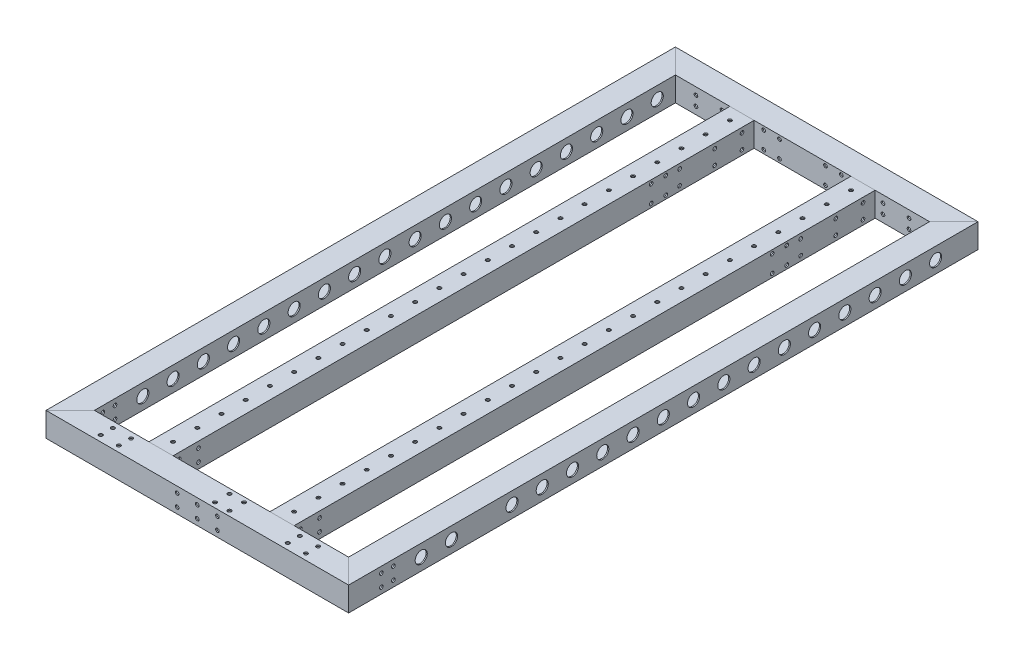
from build123d import *

# Parameters (mm, degrees)
WL_20X20X1_1_DEPTH         = 245.142135624
WL_20X20X1_1_DEPTH_BACK    = 15.142135624
SKETCH_11_W                = 20
SKETCH_11_H                = 20
SKETCH_11_W_2              = 18
SKETCH_11_H_2              = 18
SKETCH_11_ON_SEGMENT_2_W   = 20
SKETCH_11_ON_SEGMENT_2_H   = 20
SKETCH_11_ON_SEGMENT_2_W_2 = 18
SKETCH_11_ON_SEGMENT_2_H_2 = 18
WL_20X20X1_1_2_DEPTH       = 530.284271247
SKETCH_11_ON_SEGMENT_3_W   = 20
SKETCH_11_ON_SEGMENT_3_H   = 20
SKETCH_11_ON_SEGMENT_3_W_2 = 18
SKETCH_11_ON_SEGMENT_3_H_2 = 18
WL_20X20X1_1_3_DEPTH       = 260.284271247
SKETCH_11_ON_SEGMENT_4_W   = 20
SKETCH_11_ON_SEGMENT_4_H   = 20
SKETCH_11_ON_SEGMENT_4_W_2 = 18
SKETCH_11_ON_SEGMENT_4_H_2 = 18
WL_20X20X1_1_4_DEPTH       = 530.284271247
SKETCH_11_ON_SEGMENT_5_W   = 20
SKETCH_11_ON_SEGMENT_5_H   = 20
SKETCH_11_ON_SEGMENT_5_W_2 = 18
SKETCH_11_ON_SEGMENT_5_H_2 = 18
WL_20X20X1_1_5_DEPTH       = 502
SKETCH_11_ON_SEGMENT_6_W   = 20
SKETCH_11_ON_SEGMENT_6_H   = 20
SKETCH_11_ON_SEGMENT_6_W_2 = 18
SKETCH_11_ON_SEGMENT_6_H_2 = 18
WL_20X20X1_1_6_DEPTH       = 502
SKETCH_14_R                = 1.5
CUT_EXTRUDE_2_DEPTH        = 20
SKETCH_15_R                = 1.5
CUT_EXTRUDE_3_DEPTH        = 20
SKETCH_19_R                = 1.5
CUT_EXTRUDE_7_DEPTH        = 20
SKETCH_20_R                = 1.5
CUT_EXTRUDE_8_DEPTH        = 20
CUT_EXTRUDE_START          = -120
SKETCH_22_R                = 1.5
CUT_EXTRUDE_9_DEPTH        = 120
SKETCH_23_R                = 1.5
CUT_EXTRUDE_10_DEPTH       = 20
SKETCH_24_R                = 1.5
CUT_EXTRUDE_11_DEPTH       = 130
CUT_EXTRUDE_12_DEPTH       = 100
CUT_EXTRUDE_12_DEPTH_BACK  = 20
SKETCH_25_R                = 1.5
SKETCH_26_R                = 1.5
CUT_EXTRUDE_13_DEPTH       = 290.179874818
SKETCH_28_R                = 5
CUT_EXTRUDE_15_DEPTH       = 20
SKETCH_29_R                = 5
CUT_EXTRUDE_16_DEPTH       = 20
SKETCH_30_R                = 1.5
CUT_EXTRUDE_17_DEPTH       = 290.179874818


with BuildPart() as part:
    # 草图11 → Wl 20X20X1(1) (new, two sides: drawn at the far end of the back side and taken through both)
    with BuildSketch(Plane(origin=(-115, 0, -250), x_dir=(0, 0, -1), z_dir=(1, 0, 0)).offset(-WL_20X20X1_1_DEPTH_BACK)):
        Rectangle(SKETCH_11_W, SKETCH_11_H)
        Rectangle(SKETCH_11_W_2, SKETCH_11_H_2, mode=Mode.SUBTRACT)
    extrude(amount=WL_20X20X1_1_DEPTH + WL_20X20X1_1_DEPTH_BACK)

    # Wl 20X20X1(1) mitre 1
    split(bisect_by=Plane(origin=(-115, 0, -250), x_dir=(0, 1, 0), z_dir=(0.707106781, 0, -0.707106781)), keep=Keep.TOP)

    # Wl 20X20X1(1) mitre 2
    split(bisect_by=Plane(origin=(115, 0, -250), x_dir=(0, -1, 0), z_dir=(-0.707106781, 0, -0.707106781)), keep=Keep.TOP)

    # 草图15 → 切除-拉伸3 (cut)
    with BuildSketch(Plane(origin=(51.249198072, -42.818573255, -240), x_dir=(1, 0, 0), z_dir=(0, 0, 1))):
        with Locations((15.250801928, 38.818573255)):
            Circle(SKETCH_15_R)
        with Locations((15.250801928, 46.818573255)):
            Circle(SKETCH_15_R)
        with Locations((36.750801928, 46.818573255)):
            Circle(SKETCH_15_R)
        with Locations((36.750801928, 38.818573255)):
            Circle(SKETCH_15_R)
        with Locations((-139.249198072, 38.818573255)):
            Circle(SKETCH_15_R)
        with Locations((-139.249198072, 46.818573255)):
            Circle(SKETCH_15_R)
        with Locations((-117.749198072, 38.818573255)):
            Circle(SKETCH_15_R)
        with Locations((-117.749198072, 46.818573255)):
            Circle(SKETCH_15_R)
        with Locations((-70.249198072, 35.818573255)):
            Circle(SKETCH_15_R)
        with Locations((-70.249198072, 49.818573255)):
            Circle(SKETCH_15_R)
        with Locations((-83.249198072, 35.818573255)):
            Circle(SKETCH_15_R)
        with Locations((-83.249198072, 49.818573255)):
            Circle(SKETCH_15_R)
        with Locations((-32.249198072, 49.818573255)):
            Circle(SKETCH_15_R)
        with Locations((-32.249198072, 35.818573255)):
            Circle(SKETCH_15_R)
        with Locations((-19.249198072, 35.818573255)):
            Circle(SKETCH_15_R)
        with Locations((-19.249198072, 49.818573255)):
            Circle(SKETCH_15_R)
    extrude(amount=-CUT_EXTRUDE_3_DEPTH, mode=Mode.SUBTRACT)


with BuildPart() as body_2:
    # 草图11 on segment 2 (carried to segment 2) → Wl 20X20X1_1 2 (new body)
    with BuildSketch(Plane(origin=(115, 0, -265.142135624), x_dir=(1, 0, 0), z_dir=(0, 0, 1))):
        Rectangle(SKETCH_11_ON_SEGMENT_2_W, SKETCH_11_ON_SEGMENT_2_H)
        Rectangle(SKETCH_11_ON_SEGMENT_2_W_2, SKETCH_11_ON_SEGMENT_2_H_2, mode=Mode.SUBTRACT)
    extrude(amount=WL_20X20X1_1_2_DEPTH)

    # Wl 20X20X1_1 2 mitre 1
    split(bisect_by=Plane(origin=(115, 0, 250), x_dir=(0, 1, 0), z_dir=(0.707106781, 0, -0.707106781)), keep=Keep.TOP)

    # Wl 20X20X1_1 2 mitre 2
    split(bisect_by=Plane(origin=(115, 0, -250), x_dir=(0, 1, 0), z_dir=(0.707106781, 0, 0.707106781)), keep=Keep.TOP)

    # 草图20 → 切除-拉伸8 (cut)
    with BuildSketch(Plane(origin=(125, 0, 0), x_dir=(0, 0, -1), z_dir=(1, 0, 0))):
        with Locations(Location((-233, 5, 0), (0, 0, 180))):
            Circle(SKETCH_20_R)
        with Locations(Location((-223, 5, 0), (0, 0, 180))):
            Circle(SKETCH_20_R)
        with Locations(Location((-223, -5, 0), (0, 0, 180))):
            Circle(SKETCH_20_R)
        with Locations(Location((-233, -5, 0), (0, 0, 180))):
            Circle(SKETCH_20_R)
    extrude(amount=-CUT_EXTRUDE_8_DEPTH, mode=Mode.SUBTRACT)

    # 草图28 → 切除-拉伸15 (cut)
    with BuildSketch(Plane(origin=(125, 0, 0), x_dir=(0, 0, -1), z_dir=(1, 0, 0))):
        Circle(SKETCH_28_R)
        with Locations((25, 0)):
            Circle(SKETCH_28_R)
        with Locations((50, 0)):
            Circle(SKETCH_28_R)
        with Locations((75, 0)):
            Circle(SKETCH_28_R)
        with Locations((100, 0)):
            Circle(SKETCH_28_R)
        with Locations((125, 0)):
            Circle(SKETCH_28_R)
        with Locations((150, 0)):
            Circle(SKETCH_28_R)
        with Locations((175, 0)):
            Circle(SKETCH_28_R)
        with Locations((200, 0)):
            Circle(SKETCH_28_R)
        with Locations((225, 0)):
            Circle(SKETCH_28_R)
        with Locations(Location((-200, 0, 0), (0, 0, 180))):
            Circle(SKETCH_28_R)
        with Locations(Location((-175, 0, 0), (0, 0, 180))):
            Circle(SKETCH_28_R)
        with Locations(Location((-125, 0, 0), (0, 0, 180))):
            Circle(SKETCH_28_R)
        with Locations(Location((-100, 0, 0), (0, 0, 180))):
            Circle(SKETCH_28_R)
        with Locations(Location((-75, 0, 0), (0, 0, 180))):
            Circle(SKETCH_28_R)
        with Locations(Location((-50, 0, 0), (0, 0, 180))):
            Circle(SKETCH_28_R)
        with Locations(Location((-25, 0, 0), (0, 0, 180))):
            Circle(SKETCH_28_R)
    extrude(amount=-CUT_EXTRUDE_15_DEPTH, mode=Mode.SUBTRACT)


with BuildPart() as body_3:
    # 草图11 on segment 3 (carried to segment 3) → Wl 20X20X1_1 3 (new body)
    with BuildSketch(Plane(origin=(130.142135624, 0, 250), x_dir=(0, 0, 1), z_dir=(-1, 0, 0))):
        Rectangle(SKETCH_11_ON_SEGMENT_3_W, SKETCH_11_ON_SEGMENT_3_H)
        Rectangle(SKETCH_11_ON_SEGMENT_3_W_2, SKETCH_11_ON_SEGMENT_3_H_2, mode=Mode.SUBTRACT)
    extrude(amount=WL_20X20X1_1_3_DEPTH)

    # Wl 20X20X1_1 3 mitre 1
    split(bisect_by=Plane(origin=(-115, 0, 250), x_dir=(0, 1, 0), z_dir=(0.707106781, 0, 0.707106781)), keep=Keep.TOP)

    # Wl 20X20X1_1 3 mitre 2
    split(bisect_by=Plane(origin=(115, 0, 250), x_dir=(0, -1, 0), z_dir=(-0.707106781, 0, 0.707106781)), keep=Keep.TOP)

    # 草图23 → 切除-拉伸10 (cut)
    with BuildSketch(Plane.XY.offset(260)):
        with Locations((-16.6, 5)):
            Circle(SKETCH_23_R)
        with Locations(Location((16.6, 5, 0), (0, 0, 180))):
            Circle(SKETCH_23_R)
        with Locations(Location((-16.6, -5, 0), (0, 0, 180))):
            Circle(SKETCH_23_R)
        with Locations((16.6, -5)):
            Circle(SKETCH_23_R)
        with Locations((0, 5)):
            Circle(SKETCH_23_R)
        with Locations((0, -5)):
            Circle(SKETCH_23_R)
    extrude(amount=-CUT_EXTRUDE_10_DEPTH, mode=Mode.SUBTRACT)

    # 草图26 → 切除-拉伸13 (cut, through all)
    with BuildSketch(Plane(origin=(0, 10, 0), x_dir=(1, 0, 0), z_dir=(0, 1, 0))):
        with Locations(Location((10.6, -244, 0), (0, 0, 270))):
            Circle(SKETCH_26_R)
        with Locations(Location((22.6, -244, 0), (0, 0, 270))):
            Circle(SKETCH_26_R)
        with Locations(Location((10.6, -256, 0), (0, 0, 270))):
            Circle(SKETCH_26_R)
        with Locations(Location((22.6, -256, 0), (0, 0, 270))):
            Circle(SKETCH_26_R)
    extrude(amount=-CUT_EXTRUDE_13_DEPTH, mode=Mode.SUBTRACT)

    # 草图30 → 切除-拉伸17 (cut, through all)
    with BuildSketch(Plane(origin=(0, 10, 0), x_dir=(1, 0, 0), z_dir=(0, 1, 0))):
        with Locations(Location((69.75, -245, 0), (0, 0, 270))):
            Circle(SKETCH_30_R)
        with Locations(Location((84.75, -245, 0), (0, 0, 270))):
            Circle(SKETCH_30_R)
        with Locations(Location((84.75, -255, 0), (0, 0, 270))):
            Circle(SKETCH_30_R)
        with Locations(Location((69.75, -255, 0), (0, 0, 270))):
            Circle(SKETCH_30_R)
        with Locations(Location((-69.75, -255, 0), (0, 0, 270))):
            Circle(SKETCH_30_R)
        with Locations(Location((-84.75, -255, 0), (0, 0, 270))):
            Circle(SKETCH_30_R)
        with Locations(Location((-84.75, -245, 0), (0, 0, 270))):
            Circle(SKETCH_30_R)
        with Locations(Location((-69.75, -245, 0), (0, 0, 270))):
            Circle(SKETCH_30_R)
    extrude(amount=-CUT_EXTRUDE_17_DEPTH, mode=Mode.SUBTRACT)


with BuildPart() as body_4:
    # 草图11 on segment 4 (carried to segment 4) → Wl 20X20X1_1 4 (new body)
    with BuildSketch(Plane(origin=(-115, 0, 265.142135624), x_dir=(-1, 0, 0), z_dir=(0, 0, -1))):
        Rectangle(SKETCH_11_ON_SEGMENT_4_W, SKETCH_11_ON_SEGMENT_4_H)
        Rectangle(SKETCH_11_ON_SEGMENT_4_W_2, SKETCH_11_ON_SEGMENT_4_H_2, mode=Mode.SUBTRACT)
    extrude(amount=WL_20X20X1_1_4_DEPTH)

    # Wl 20X20X1_1 4 mitre 1
    split(bisect_by=Plane(origin=(-115, 0, 250), x_dir=(0, -1, 0), z_dir=(-0.707106781, 0, -0.707106781)), keep=Keep.TOP)

    # Wl 20X20X1_1 4 mitre 2
    split(bisect_by=Plane(origin=(-115, 0, -250), x_dir=(0, -1, 0), z_dir=(-0.707106781, 0, 0.707106781)), keep=Keep.TOP)

    # 草图19 → 切除-拉伸7 (cut)
    with BuildSketch(Plane.ZY.offset(125)):
        with Locations((223, 5)):
            Circle(SKETCH_19_R)
        with Locations((223, -5)):
            Circle(SKETCH_19_R)
        with Locations((233, -5)):
            Circle(SKETCH_19_R)
        with Locations((233, 5)):
            Circle(SKETCH_19_R)
    extrude(amount=-CUT_EXTRUDE_7_DEPTH, mode=Mode.SUBTRACT)

    # 草图29 → 切除-拉伸16 (cut)
    with BuildSketch(Plane.ZY.offset(125)):
        Circle(SKETCH_29_R)
        with Locations((25, 0)):
            Circle(SKETCH_29_R)
        with Locations((50, 0)):
            Circle(SKETCH_29_R)
        with Locations((75, 0)):
            Circle(SKETCH_29_R)
        with Locations((100, 0)):
            Circle(SKETCH_29_R)
        with Locations((125, 0)):
            Circle(SKETCH_29_R)
        with Locations((150, 0)):
            Circle(SKETCH_29_R)
        with Locations((175, 0)):
            Circle(SKETCH_29_R)
        with Locations((200, 0)):
            Circle(SKETCH_29_R)
        with Locations(Location((-225, 0, 0), (0, 0, 180))):
            Circle(SKETCH_29_R)
        with Locations(Location((-200, 0, 0), (0, 0, 180))):
            Circle(SKETCH_29_R)
        with Locations(Location((-175, 0, 0), (0, 0, 180))):
            Circle(SKETCH_29_R)
        with Locations(Location((-150, 0, 0), (0, 0, 180))):
            Circle(SKETCH_29_R)
        with Locations(Location((-125, 0, 0), (0, 0, 180))):
            Circle(SKETCH_29_R)
        with Locations(Location((-100, 0, 0), (0, 0, 180))):
            Circle(SKETCH_29_R)
        with Locations(Location((-75, 0, 0), (0, 0, 180))):
            Circle(SKETCH_29_R)
        with Locations(Location((-50, 0, 0), (0, 0, 180))):
            Circle(SKETCH_29_R)
        with Locations(Location((-25, 0, 0), (0, 0, 180))):
            Circle(SKETCH_29_R)
    extrude(amount=-CUT_EXTRUDE_16_DEPTH, mode=Mode.SUBTRACT)


with BuildPart() as body_5:
    # 草图11 on segment 5 (carried to segment 5) → Wl 20X20X1_1 5 (new body)
    with BuildSketch(Plane(origin=(-50, 0, -251), x_dir=(1, 0, 0), z_dir=(0, 0, 1))):
        Rectangle(SKETCH_11_ON_SEGMENT_5_W, SKETCH_11_ON_SEGMENT_5_H)
        Rectangle(SKETCH_11_ON_SEGMENT_5_W_2, SKETCH_11_ON_SEGMENT_5_H_2, mode=Mode.SUBTRACT)
    extrude(amount=WL_20X20X1_1_5_DEPTH)

    # Wl 20X20X1_1 5 mitre 1
    split(bisect_by=Plane(origin=(-50, 0, -240), x_dir=(0, -1, 0), z_dir=(0, 0, 1)), keep=Keep.TOP)

    # Wl 20X20X1_1 5 mitre 2
    split(bisect_by=Plane(origin=(-50, 0, 240), x_dir=(0, 1, 0), z_dir=(0, 0, -1)), keep=Keep.TOP)


with BuildPart() as body_6:
    # 草图11 on segment 6 (carried to segment 6) → Wl 20X20X1_1 6 (new body)
    with BuildSketch(Plane(origin=(50, 0, -251), x_dir=(1, 0, 0), z_dir=(0, 0, 1))):
        Rectangle(SKETCH_11_ON_SEGMENT_6_W, SKETCH_11_ON_SEGMENT_6_H)
        Rectangle(SKETCH_11_ON_SEGMENT_6_W_2, SKETCH_11_ON_SEGMENT_6_H_2, mode=Mode.SUBTRACT)
    extrude(amount=WL_20X20X1_1_6_DEPTH)

    # Wl 20X20X1_1 6 mitre 1
    split(bisect_by=Plane(origin=(50, 0, -240), x_dir=(0, -1, 0), z_dir=(0, 0, 1)), keep=Keep.TOP)

    # Wl 20X20X1_1 6 mitre 2
    split(bisect_by=Plane(origin=(50, 0, 240), x_dir=(0, 1, 0), z_dir=(0, 0, -1)), keep=Keep.TOP)


with BuildPart() as cut_extrude_2_tool:
    # 草图14 → 切除-拉伸2 (new body)
    with BuildSketch(Plane(origin=(0, 10, 0), x_dir=(1, 0, 0), z_dir=(0, 1, 0))):
        with Locations(Location((-50, 230, 0), (0, 0, 270))):
            Circle(SKETCH_14_R)
        with Locations(Location((50, 230, 0), (0, 0, 270))):
            Circle(SKETCH_14_R)
        with Locations(Location((-50, 210, 0), (0, 0, 270))):
            Circle(SKETCH_14_R)
        with Locations(Location((50, 210, 0), (0, 0, 270))):
            Circle(SKETCH_14_R)
        with Locations(Location((-50, 190, 0), (0, 0, 270))):
            Circle(SKETCH_14_R)
        with Locations(Location((50, 190, 0), (0, 0, 270))):
            Circle(SKETCH_14_R)
        with Locations(Location((-50, 170, 0), (0, 0, 270))):
            Circle(SKETCH_14_R)
        with Locations(Location((50, 170, 0), (0, 0, 270))):
            Circle(SKETCH_14_R)
        with Locations(Location((-50, 150, 0), (0, 0, 270))):
            Circle(SKETCH_14_R)
        with Locations(Location((50, 150, 0), (0, 0, 270))):
            Circle(SKETCH_14_R)
        with Locations(Location((-50, 130, 0), (0, 0, 270))):
            Circle(SKETCH_14_R)
        with Locations(Location((50, 130, 0), (0, 0, 270))):
            Circle(SKETCH_14_R)
        with Locations(Location((-50, 110, 0), (0, 0, 270))):
            Circle(SKETCH_14_R)
        with Locations(Location((50, 110, 0), (0, 0, 270))):
            Circle(SKETCH_14_R)
        with Locations(Location((-50, 90, 0), (0, 0, 270))):
            Circle(SKETCH_14_R)
        with Locations(Location((50, 90, 0), (0, 0, 270))):
            Circle(SKETCH_14_R)
        with Locations(Location((-50, 70, 0), (0, 0, 270))):
            Circle(SKETCH_14_R)
        with Locations(Location((50, 70, 0), (0, 0, 270))):
            Circle(SKETCH_14_R)
        with Locations(Location((-50, 50, 0), (0, 0, 270))):
            Circle(SKETCH_14_R)
        with Locations(Location((50, 50, 0), (0, 0, 270))):
            Circle(SKETCH_14_R)
        with Locations(Location((-50, 30, 0), (0, 0, 270))):
            Circle(SKETCH_14_R)
        with Locations(Location((50, 30, 0), (0, 0, 270))):
            Circle(SKETCH_14_R)
        with Locations(Location((-50, 10, 0), (0, 0, 270))):
            Circle(SKETCH_14_R)
        with Locations(Location((50, 10, 0), (0, 0, 270))):
            Circle(SKETCH_14_R)
        with Locations(Location((-50, -10, 0), (0, 0, 270))):
            Circle(SKETCH_14_R)
        with Locations(Location((50, -10, 0), (0, 0, 270))):
            Circle(SKETCH_14_R)
        with Locations(Location((-50, -30, 0), (0, 0, 270))):
            Circle(SKETCH_14_R)
        with Locations(Location((50, -30, 0), (0, 0, 270))):
            Circle(SKETCH_14_R)
        with Locations(Location((-50, -50, 0), (0, 0, 270))):
            Circle(SKETCH_14_R)
        with Locations(Location((50, -50, 0), (0, 0, 270))):
            Circle(SKETCH_14_R)
        with Locations(Location((-50, -70, 0), (0, 0, 270))):
            Circle(SKETCH_14_R)
        with Locations(Location((50, -70, 0), (0, 0, 270))):
            Circle(SKETCH_14_R)
        with Locations(Location((-50, -90, 0), (0, 0, 270))):
            Circle(SKETCH_14_R)
        with Locations(Location((50, -90, 0), (0, 0, 270))):
            Circle(SKETCH_14_R)
        with Locations(Location((-50, -110, 0), (0, 0, 270))):
            Circle(SKETCH_14_R)
        with Locations(Location((50, -110, 0), (0, 0, 270))):
            Circle(SKETCH_14_R)
        with Locations(Location((-50, -130, 0), (0, 0, 270))):
            Circle(SKETCH_14_R)
        with Locations(Location((50, -130, 0), (0, 0, 270))):
            Circle(SKETCH_14_R)
        with Locations(Location((-50, -150, 0), (0, 0, 270))):
            Circle(SKETCH_14_R)
        with Locations(Location((50, -150, 0), (0, 0, 270))):
            Circle(SKETCH_14_R)
        with Locations(Location((-50, -170, 0), (0, 0, 270))):
            Circle(SKETCH_14_R)
        with Locations(Location((50, -170, 0), (0, 0, 270))):
            Circle(SKETCH_14_R)
        with Locations(Location((-50, -190, 0), (0, 0, 270))):
            Circle(SKETCH_14_R)
        with Locations(Location((50, -190, 0), (0, 0, 270))):
            Circle(SKETCH_14_R)
        with Locations(Location((-50, -210, 0), (0, 0, 270))):
            Circle(SKETCH_14_R)
        with Locations(Location((50, -210, 0), (0, 0, 270))):
            Circle(SKETCH_14_R)
        with Locations(Location((-50, -230, 0), (0, 0, 270))):
            Circle(SKETCH_14_R)
        with Locations(Location((50, -230, 0), (0, 0, 270))):
            Circle(SKETCH_14_R)
    extrude(amount=-CUT_EXTRUDE_2_DEPTH)


with BuildPart() as body_5_1:
    add(body_5.part)

    # 切除-拉伸2: cut by cut_extrude_2_tool
    add(cut_extrude_2_tool.part, mode=Mode.SUBTRACT)


with BuildPart() as body_6_1:
    add(body_6.part)

    # 切除-拉伸2: cut by cut_extrude_2_tool
    add(cut_extrude_2_tool.part, mode=Mode.SUBTRACT)


with BuildPart() as cut_extrude_9_tool:
    # 草图22 → 切除-拉伸9 (new body)
    with BuildSketch(Plane(origin=(60, 0, 0), x_dir=(0, 0, -1), z_dir=(1, 0, 0)).offset(CUT_EXTRUDE_START)):
        with Locations(Location((-219, -5, 0), (0, 0, 180))):
            Circle(SKETCH_22_R)
        with Locations(Location((-219, 5, 0), (0, 0, 180))):
            Circle(SKETCH_22_R)
        with Locations(Location((-235, 5, 0), (0, 0, 180))):
            Circle(SKETCH_22_R)
        with Locations(Location((-235, -5, 0), (0, 0, 180))):
            Circle(SKETCH_22_R)
    extrude(amount=CUT_EXTRUDE_9_DEPTH)


with BuildPart() as body_5_2:
    add(body_5_1.part)

    # 切除-拉伸9: cut by cut_extrude_9_tool
    add(cut_extrude_9_tool.part, mode=Mode.SUBTRACT)


with BuildPart() as body_6_2:
    add(body_6_1.part)

    # 切除-拉伸9: cut by cut_extrude_9_tool
    add(cut_extrude_9_tool.part, mode=Mode.SUBTRACT)


with BuildPart() as cut_extrude_11_tool:
    # 草图24 → 切除-拉伸11 (new body)
    with BuildSketch(Plane(origin=(60, 0, 0), x_dir=(0, 0, -1), z_dir=(1, 0, 0))):
        with Locations(Location((155, 7, 0), (0, 0, 180))):
            Circle(SKETCH_24_R)
        with Locations(Location((167, 7, 0), (0, 0, 180))):
            Circle(SKETCH_24_R)
        with Locations(Location((155, -7, 0), (0, 0, 180))):
            Circle(SKETCH_24_R)
        with Locations(Location((167, -7, 0), (0, 0, 180))):
            Circle(SKETCH_24_R)
    extrude(amount=-CUT_EXTRUDE_11_DEPTH)


with BuildPart() as body_5_3:
    add(body_5_2.part)

    # 切除-拉伸11: cut by cut_extrude_11_tool
    add(cut_extrude_11_tool.part, mode=Mode.SUBTRACT)


with BuildPart() as body_6_3:
    add(body_6_2.part)

    # 切除-拉伸11: cut by cut_extrude_11_tool
    add(cut_extrude_11_tool.part, mode=Mode.SUBTRACT)


with BuildPart() as cut_extrude_12_tool:
    # 草图25 → 切除-拉伸12 (new, two sides: drawn at the far end of the back side and taken through both)
    with BuildSketch(Plane(origin=(40, -42.818573255, 0), x_dir=(0, 0, 1), z_dir=(-1, 0, 0)).offset(-CUT_EXTRUDE_12_DEPTH_BACK)):
        with Locations((-178.5, 36.818573255)):
            Circle(SKETCH_25_R)
        with Locations((-178.5, 48.818573255)):
            Circle(SKETCH_25_R)
        with Locations((-230, 36.818573255)):
            Circle(SKETCH_25_R)
        with Locations((-230, 48.818573255)):
            Circle(SKETCH_25_R)
        with Locations((-207.5, 36.818573255)):
            Circle(SKETCH_25_R)
        with Locations((-207.5, 48.818573255)):
            Circle(SKETCH_25_R)
    extrude(amount=CUT_EXTRUDE_12_DEPTH + CUT_EXTRUDE_12_DEPTH_BACK)


with BuildPart() as body_5_4:
    add(body_5_3.part)

    # 切除-拉伸12: cut by cut_extrude_12_tool
    add(cut_extrude_12_tool.part, mode=Mode.SUBTRACT)


with BuildPart() as body_6_4:
    add(body_6_3.part)

    # 切除-拉伸12: cut by cut_extrude_12_tool
    add(cut_extrude_12_tool.part, mode=Mode.SUBTRACT)


solid = Compound([part.part, body_2.part, body_3.part, body_4.part, body_5_4.part, body_6_4.part])
